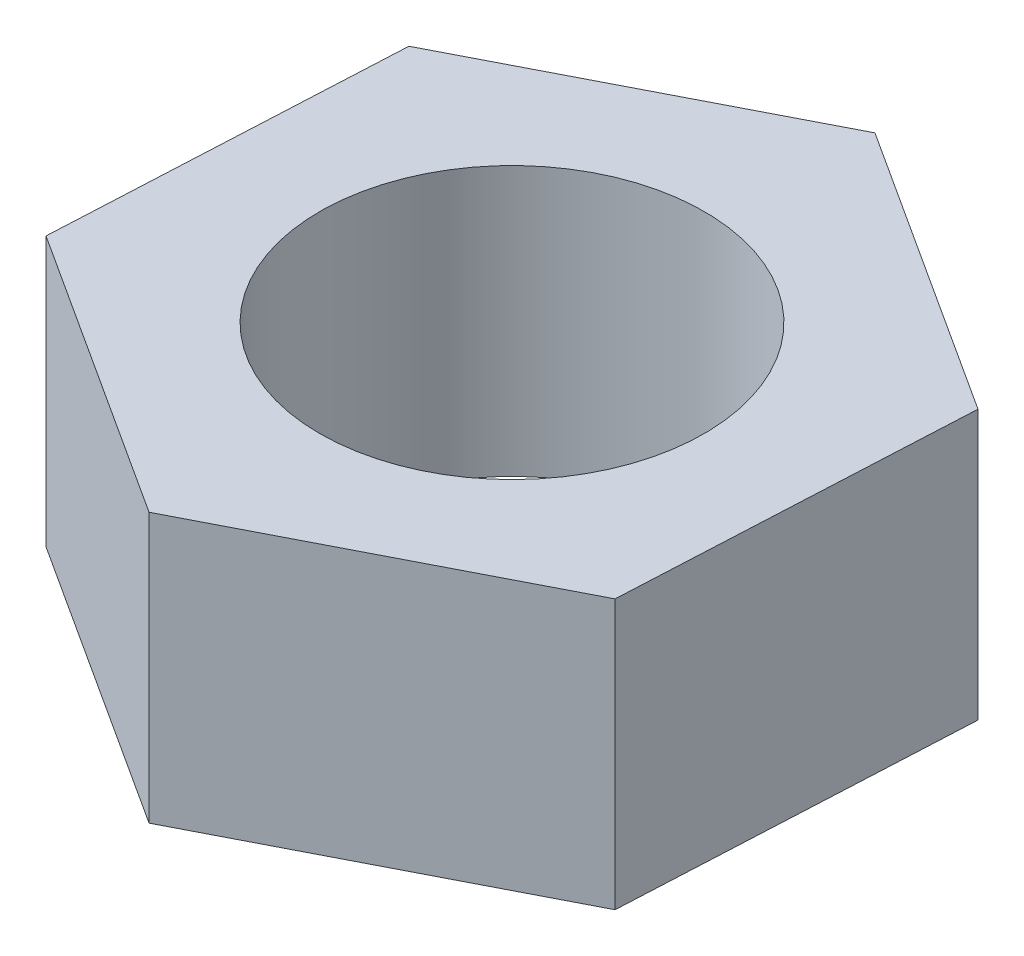
from build123d import *

# Parameters (mm, degrees)
EXTRUDE_1_DEPTH     = 3.5
SKETCH_2_R          = 2.5
CUT_EXTRUDE_2_DEPTH = 3.5


with BuildPart() as part:
    # Эскиз1 → Вытянуть1 (new body)
    with BuildSketch(Plane(origin=(0, 0, 0), x_dir=(1, 0, 0), z_dir=(0, 1, 0))):
        Polygon((3.780519523, -2.440834311), (4.004084281, 2.053608791), (0.223564758, 4.494443102), (-3.780519523, 2.440834311), (-4.004084281, -2.053608791), (-0.223564758, -4.494443102), align=None)
    extrude(amount=EXTRUDE_1_DEPTH)

    # Эскиз2 → Вытянуть2 (cut)
    with BuildSketch(Plane(origin=(0, 3.5, 0), x_dir=(1, 0, 0), z_dir=(0, 1, 0))):
        with Locations(Location((0, 0, 0), (0, 0, 270))):
            Circle(SKETCH_2_R)
    extrude(amount=-CUT_EXTRUDE_2_DEPTH, mode=Mode.SUBTRACT)


solid = part.part
